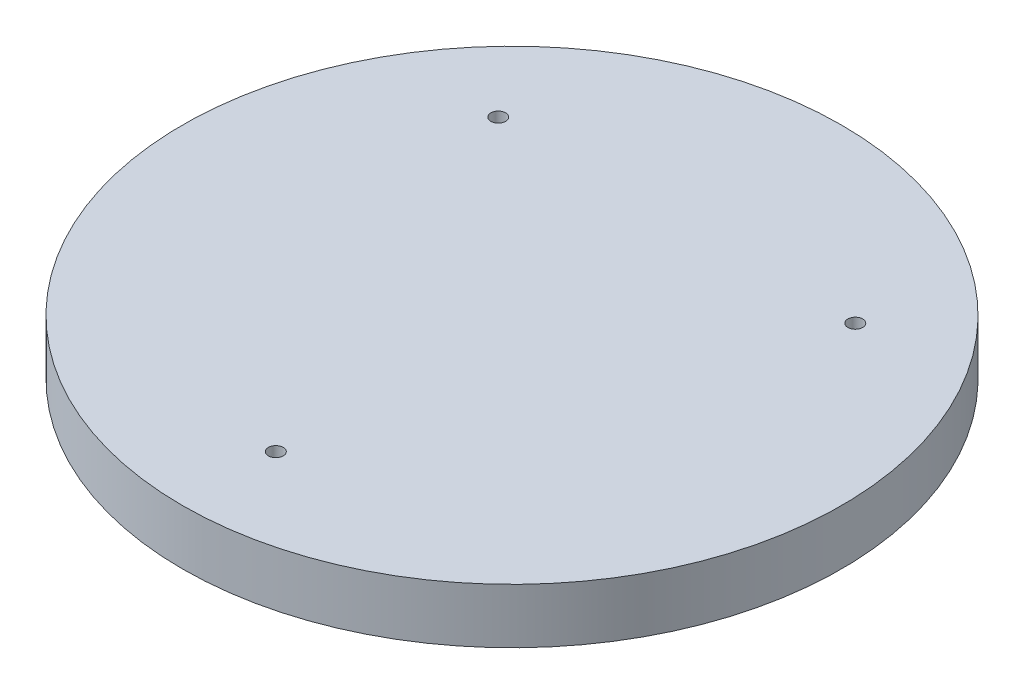
from build123d import *

# Parameters (mm, degrees)
SKETCH1_R           = 152.4
BOSS_EXTRUDE1_DEPTH = 25.4
SKETCH2_R           = 3.429
CUT_EXTRUDE1_DEPTH  = 12.7


with BuildPart() as part:
    # Sketch1 → Boss-Extrude1 (new body)
    with BuildSketch(Plane(origin=(0, 0, 0), x_dir=(1, 0, 0), z_dir=(0, 1, 0))):
        with Locations(Location((0, 0, 0), (0, 0, 270))):
            Circle(SKETCH1_R)
    extrude(amount=BOSS_EXTRUDE1_DEPTH)

    # Sketch2 → Cut-Extrude1 (cut)
    with BuildSketch(Plane(origin=(0, 25.4, 0), x_dir=(1, 0, 0), z_dir=(0, 1, 0))):
        with Locations(Location((-82.55, 76.2, 0), (0, 0, 270))):
            Circle(SKETCH2_R)
        with Locations(Location((82.55, 76.2, 0), (0, 0, 270))):
            Circle(SKETCH2_R)
        with Locations(Location((0, -109.22, 0), (0, 0, 270))):
            Circle(SKETCH2_R)
    extrude(amount=-CUT_EXTRUDE1_DEPTH, mode=Mode.SUBTRACT)


solid = part.part
